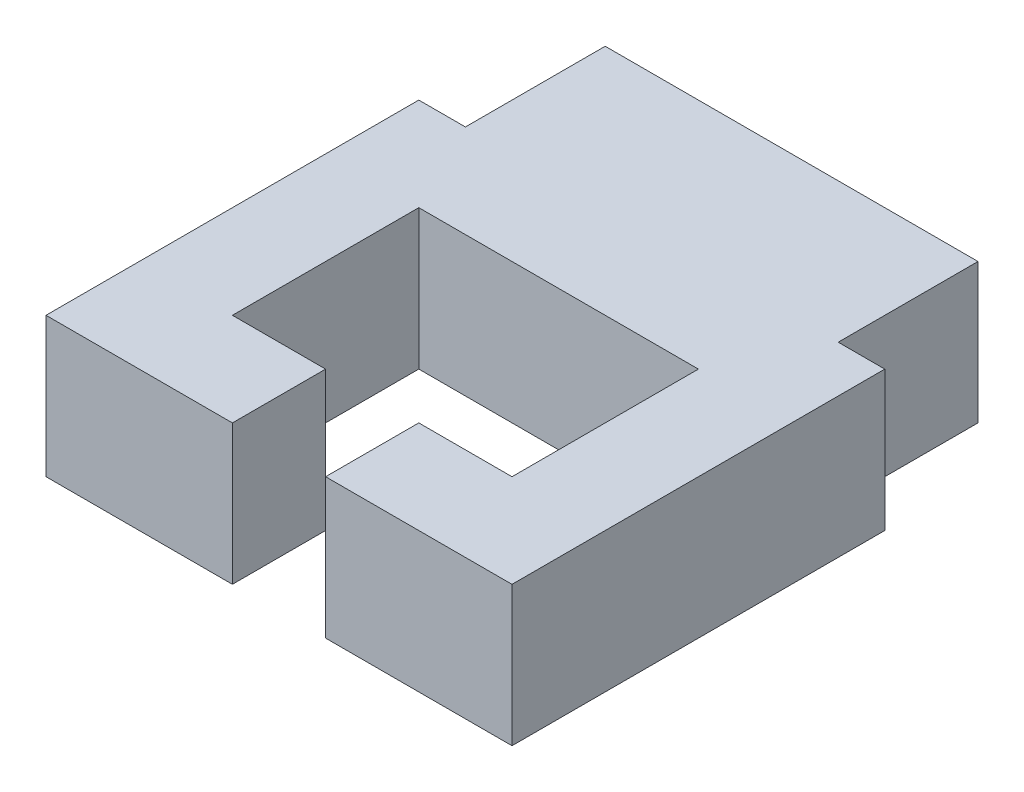
from build123d import *

# Parameters (mm, degrees)
SKETCH4_W           = 10
SKETCH4_H           = 3
BOSS_EXTRUDE2_DEPTH = 2
SKETCH5_W           = 4
SKETCH5_H           = 3
BOSS_EXTRUDE3_DEPTH = 3
SKETCH6_W           = 2
SKETCH6_H           = 3
BOSS_EXTRUDE4_DEPTH = 6
SKETCH7_W           = 2
SKETCH7_H           = 3
BOSS_EXTRUDE5_DEPTH = 2
SKETCH8_W           = 2
SKETCH8_H           = 3
BOSS_EXTRUDE6_DEPTH = 2


with BuildPart() as part:
    # Sketch4 → Boss-Extrude2 (new body)
    with BuildSketch(Plane.XY):
        with Locations((-112.42360649, 35.715193832)):
            Rectangle(SKETCH4_W, SKETCH4_H)
    extrude(amount=BOSS_EXTRUDE2_DEPTH)

    # Sketch5 → Boss-Extrude3 (add)
    with BuildSketch(Plane(origin=(0, 0, 0), x_dir=(-1, 0, 0), z_dir=(0, 0, -1))):
        with Locations((114.42360649, 35.715193832)):
            Rectangle(SKETCH5_W, SKETCH5_H)
        with Locations((110.42360649, 35.715193832)):
            Rectangle(SKETCH5_W, SKETCH5_H)
    extrude(amount=BOSS_EXTRUDE3_DEPTH)

    # Sketch6 → Boss-Extrude4 (add)
    with BuildSketch(Plane.XY.offset(2)):
        with Locations((-108.42360649, 35.715193832)):
            Rectangle(SKETCH6_W, SKETCH6_H)
        with Locations((-116.42360649, 35.715193832)):
            Rectangle(SKETCH6_W, SKETCH6_H)
    extrude(amount=BOSS_EXTRUDE4_DEPTH)

    # Sketch7 → Boss-Extrude5 (add)
    with BuildSketch(Plane(origin=(-115.42360649, 0, 0), x_dir=(0, 0, -1), z_dir=(1, 0, 0))):
        with Locations((-7, 35.715193832)):
            Rectangle(SKETCH7_W, SKETCH7_H)
    extrude(amount=BOSS_EXTRUDE5_DEPTH)

    # Sketch8 → Boss-Extrude6 (add)
    with BuildSketch(Plane.ZY.offset(109.42360649)):
        with Locations((7, 35.715193832)):
            Rectangle(SKETCH8_W, SKETCH8_H)
    extrude(amount=BOSS_EXTRUDE6_DEPTH)


solid = part.part
